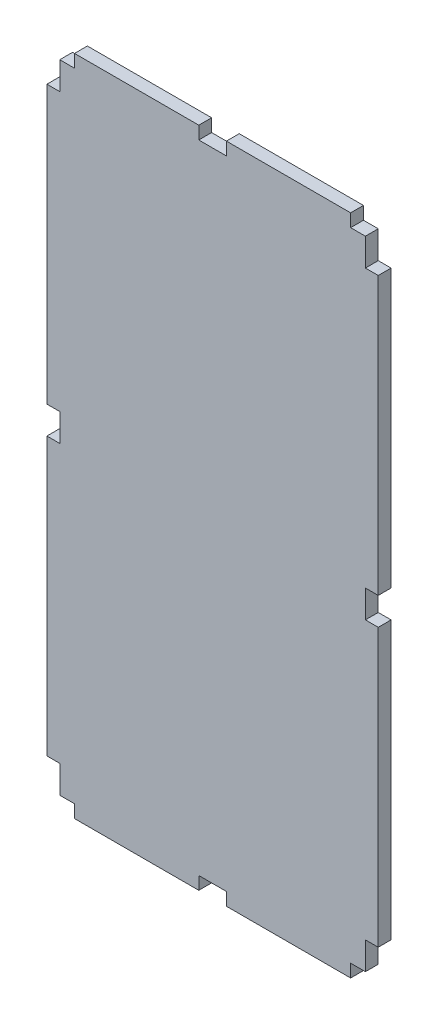
from build123d import *

# Parameters (mm, degrees)
BASE_SKETCH_W           = 304.8
BASE_SKETCH_H           = 609.6
BOSS_EXTRUDE1_DEPTH     = 11.81
JOINT_X_W               = 25.4
JOINT_X_H               = 11.81
CUT_EXTRUDE1_DEPTH      = 536.943693755
LPATTERN1_COUNT         = 3
LPATTERN1_PITCH         = 139.7
MIRROR1_COPY_1_SKETCH_W = 25.4
MIRROR1_COPY_1_SKETCH_H = 11.81
MIRROR1_COPY_1_DEPTH    = 536.943693755
MIRROR1_COPY_2_SKETCH_W = 25.4
MIRROR1_COPY_2_SKETCH_H = 11.81
MIRROR1_COPY_2_DEPTH    = 536.943693755
JOINT_Y_W               = 11.81
JOINT_Y_H               = 25.4
CUT_EXTRUDE2_DEPTH      = 536.943693755
LPATTERN3_COUNT         = 3
LPATTERN3_PITCH         = 280.29
MIRROR4_COPY_1_SKETCH_W = 11.81
MIRROR4_COPY_1_SKETCH_H = 25.4
MIRROR4_COPY_1_DEPTH    = 536.943693755
MIRROR4_COPY_2_SKETCH_W = 11.81
MIRROR4_COPY_2_SKETCH_H = 25.4
MIRROR4_COPY_2_DEPTH    = 536.943693755


with BuildPart() as part:
    # Base_Sketch → Boss-Extrude1 (new body)
    with BuildSketch(Plane.XY):
        with Locations((127, 152.399963665)):
            Rectangle(BASE_SKETCH_W, BASE_SKETCH_H)
    extrude(amount=BOSS_EXTRUDE1_DEPTH)

    # Joint_X → Cut-Extrude1 (cut, through all)
    with BuildSketch(Plane.XY.offset(11.81)):
        with Locations((-12.7, -146.495036335)):
            Rectangle(JOINT_X_W, JOINT_X_H)
    cut_extrude1 = extrude(amount=-CUT_EXTRUDE1_DEPTH, mode=Mode.SUBTRACT)

    # LPattern1: Cut-Extrude1 ×3
    with Locations(*[(i * LPATTERN1_PITCH, 0, 0) for i in range(1, LPATTERN1_COUNT)]):
        add(cut_extrude1, mode=Mode.SUBTRACT)

    # Mirror1: Cut-Extrude1 across plane
    add(cut_extrude1.mirror(Plane(origin=(0, 152.399963665, 0), x_dir=(0, 0, 1), z_dir=(0, -1, 0))), mode=Mode.SUBTRACT)

    # Mirror1 copy 1 sketch → Mirror1 copy 1 (cut, through all)
    with BuildSketch(Plane(origin=(139.7, 304.79992733, 11.81), x_dir=(1, 0, 0), z_dir=(0, 0, 1))):
        with Locations((-12.7, 146.495036335)):
            Rectangle(MIRROR1_COPY_1_SKETCH_W, MIRROR1_COPY_1_SKETCH_H)
    extrude(amount=-MIRROR1_COPY_1_DEPTH, mode=Mode.SUBTRACT)

    # Mirror1 copy 2 sketch → Mirror1 copy 2 (cut, through all)
    with BuildSketch(Plane(origin=(279.4, 304.79992733, 11.81), x_dir=(1, 0, 0), z_dir=(0, 0, 1))):
        with Locations((-12.7, 146.495036335)):
            Rectangle(MIRROR1_COPY_2_SKETCH_W, MIRROR1_COPY_2_SKETCH_H)
    extrude(amount=-MIRROR1_COPY_2_DEPTH, mode=Mode.SUBTRACT)

    # Joint_Y → Cut-Extrude2 (cut, through all)
    with BuildSketch(Plane.XY.offset(11.81)):
        with Locations((-19.495, -127.890036335)):
            Rectangle(JOINT_Y_W, JOINT_Y_H)
    cut_extrude2 = extrude(amount=-CUT_EXTRUDE2_DEPTH, mode=Mode.SUBTRACT)

    # LPattern3: Cut-Extrude2 ×3
    with Locations(*[(0, i * LPATTERN3_PITCH, 0) for i in range(1, LPATTERN3_COUNT)]):
        add(cut_extrude2, mode=Mode.SUBTRACT)

    # Mirror4: Cut-Extrude2 across plane
    add(cut_extrude2.mirror(Plane.ZY.offset(-127)), mode=Mode.SUBTRACT)

    # Mirror4 copy 1 sketch → Mirror4 copy 1 (cut, through all)
    with BuildSketch(Plane(origin=(254, 280.29, 11.81), x_dir=(-1, 0, 0), z_dir=(0, 0, 1))):
        with Locations((-19.495, 127.890036335)):
            Rectangle(MIRROR4_COPY_1_SKETCH_W, MIRROR4_COPY_1_SKETCH_H)
    extrude(amount=-MIRROR4_COPY_1_DEPTH, mode=Mode.SUBTRACT)

    # Mirror4 copy 2 sketch → Mirror4 copy 2 (cut, through all)
    with BuildSketch(Plane(origin=(254, 560.58, 11.81), x_dir=(-1, 0, 0), z_dir=(0, 0, 1))):
        with Locations((-19.495, 127.890036335)):
            Rectangle(MIRROR4_COPY_2_SKETCH_W, MIRROR4_COPY_2_SKETCH_H)
    extrude(amount=-MIRROR4_COPY_2_DEPTH, mode=Mode.SUBTRACT)


solid = part.part
